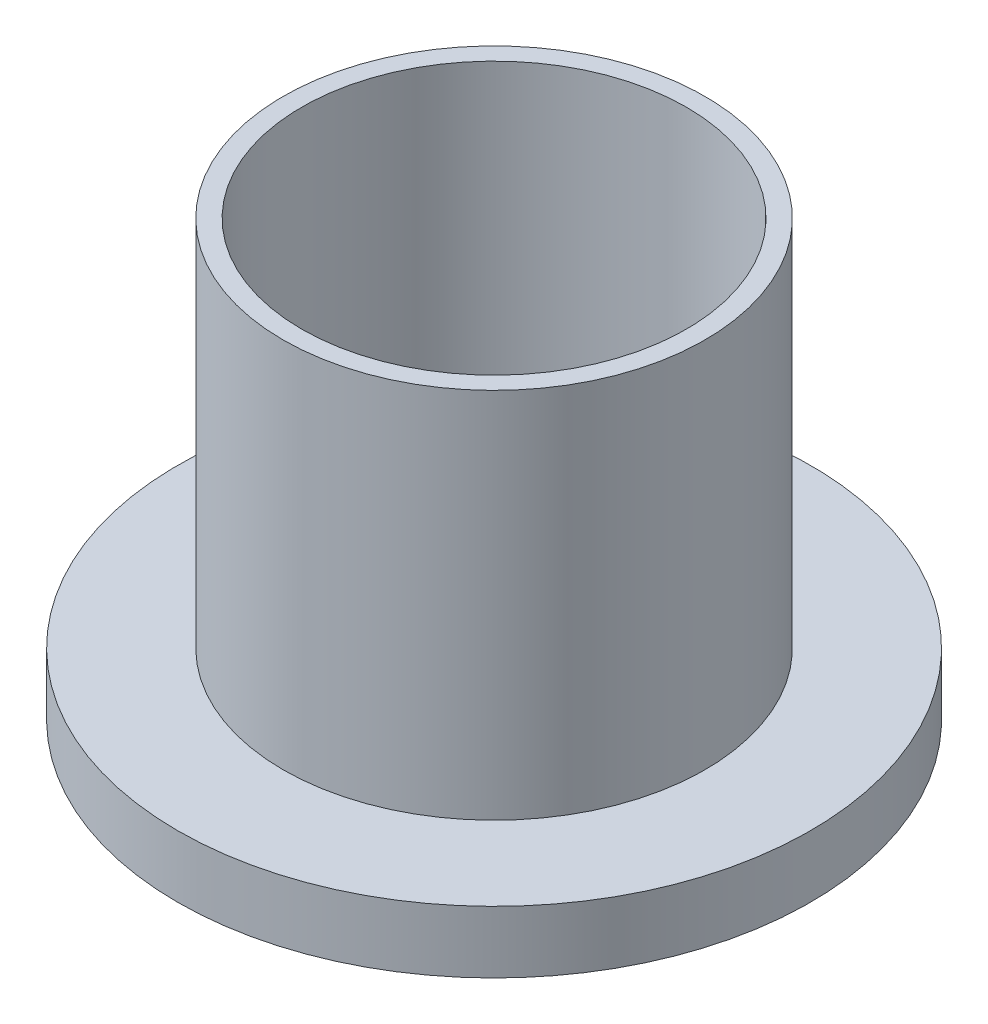
from build123d import *

# Parameters (mm, degrees)
ESQUISSE1_R        = 5.1
ESQUISSE1_R_2      = 3.1
BOSS_EXTRU_1_DEPTH = 1
ESQUISSE2_R        = 3.4
ESQUISSE2_R_2      = 3.1
BOSS_EXTRU_2_DEPTH = 6


with BuildPart() as part:
    # Esquisse1 → Boss.-Extru.1 (new body)
    with BuildSketch(Plane(origin=(0, 0, 0), x_dir=(1, 0, 0), z_dir=(0, 1, 0))):
        Circle(ESQUISSE1_R)
        Circle(ESQUISSE1_R_2, mode=Mode.SUBTRACT)
    extrude(amount=BOSS_EXTRU_1_DEPTH)

    # Esquisse2 → Boss.-Extru.2 (add)
    with BuildSketch(Plane(origin=(0, 1, 0), x_dir=(1, 0, 0), z_dir=(0, 1, 0))):
        Circle(ESQUISSE2_R)
        Circle(ESQUISSE2_R_2, mode=Mode.SUBTRACT)
    extrude(amount=BOSS_EXTRU_2_DEPTH)


solid = part.part
